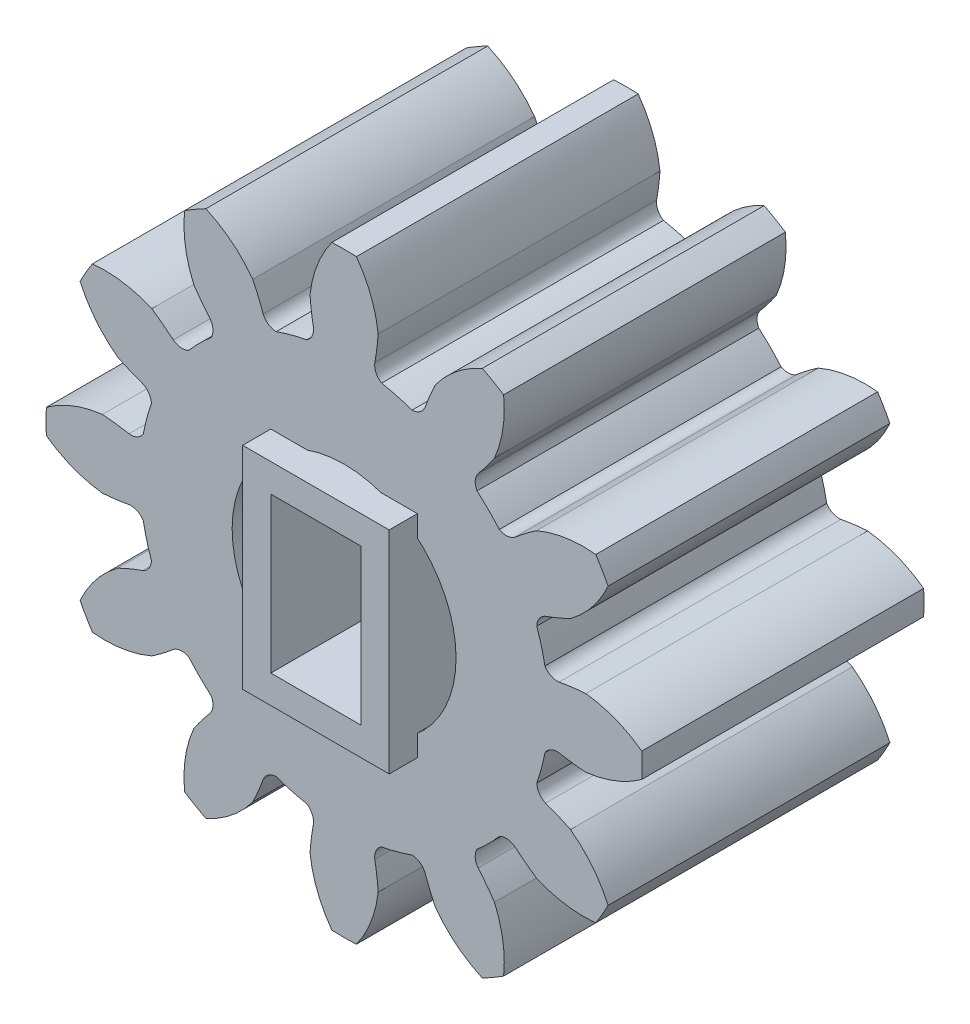
from build123d import *

# Parameters (mm, degrees)
BOSS_EXTRUDE1_DEPTH    = 10
BOSS_EXTRUDE1_2_DEPTH  = 10
BOSS_EXTRUDE1_3_DEPTH  = 10
BOSS_EXTRUDE1_4_DEPTH  = 10
BOSS_EXTRUDE1_5_DEPTH  = 10
BOSS_EXTRUDE1_6_DEPTH  = 10
BOSS_EXTRUDE1_7_DEPTH  = 10
BOSS_EXTRUDE1_8_DEPTH  = 10
BOSS_EXTRUDE1_9_DEPTH  = 10
BOSS_EXTRUDE1_10_DEPTH = 10
BOSS_EXTRUDE1_11_DEPTH = 10
BOSS_EXTRUDE1_12_DEPTH = 10
SKETCH1_R              = 7.25
SKETCH1_R_2            = 3.97260274
BOSS_EXTRUDE2_DEPTH    = 10
SKETCH3_W              = 3.2
SKETCH3_H              = 5.5
BOSS_EXTRUDE4_DEPTH    = 10
SHELL2_T               = 1


with BuildPart() as part:
    # Sketch2 → Boss-Extrude1 (new body)
    with BuildSketch(Plane.XY.offset(20)):
        with BuildLine():
            ThreePointArc((-0.43638137, 31.49092865), (0, 31.50135755), (0.43638137, 31.49092865))
            ThreePointArc((0.43638137, 31.49092865), (0.951639437, 30.546981097), (1.209067941, 29.502826691))
            ThreePointArc((1.209067941, 29.502826691), (1.162093587, 29.026837369), (1.088768363, 28.554189682))
            ThreePointArc((1.088768363, 28.554189682), (1.135140733, 28.267263714), (1.330539856, 28.052098451))
            ThreePointArc((1.330539856, 28.052098451), (0, 28.17523633), (-1.330539856, 28.052098451))
            ThreePointArc((-1.330539856, 28.052098451), (-1.135140733, 28.267263714), (-1.088768363, 28.554189682))
            ThreePointArc((-1.088768363, 28.554189682), (-1.162093587, 29.026837369), (-1.209067941, 29.502826691))
            ThreePointArc((-1.209067941, 29.502826691), (-0.951639437, 30.546981097), (-0.43638137, 31.49092865))
        make_face()
    extrude(amount=BOSS_EXTRUDE1_DEPTH)



with BuildPart() as body_2:
    # Sketch2 → Boss-Extrude1 2 (new body)
    with BuildSketch(Plane.XY.offset(20)):
        with BuildLine():
            ThreePointArc((2.411149745, 27.762549904), (3.625, 27.203920508), (4.715712376, 26.432010048))
            ThreePointArc((4.715712376, 26.432010048), (4.654074403, 26.716048194), (4.757377737, 26.987719556))
            ThreePointArc((4.757377737, 26.987719556), (5.057203087, 27.360381848), (5.335878732, 27.749113515))
            ThreePointArc((5.335878732, 27.749113515), (5.635016311, 28.782092008), (5.660763512, 29.857203603))
            ThreePointArc((5.660763512, 29.857203603), (5.28806061, 30.08442598), (4.904928808, 30.293584973))
            ThreePointArc((4.904928808, 30.293584973), (3.986728456, 29.733731446), (3.241711629, 28.958181456))
            ThreePointArc((3.241711629, 28.958181456), (3.044397952, 28.522475434), (2.871575615, 28.076487919))
            ThreePointArc((2.871575615, 28.076487919), (2.687952981, 27.851188926), (2.411149745, 27.762549904))
        make_face()
    extrude(amount=BOSS_EXTRUDE1_2_DEPTH)


with BuildPart() as body_3:
    # Sketch2 → Boss-Extrude1 3 (new body)
    with BuildSketch(Plane.XY.offset(20)):
        with BuildLine():
            ThreePointArc((5.506773718, 25.640948706), (6.278684177, 24.55023633), (6.837313574, 23.336386075))
            ThreePointArc((6.837313574, 23.336386075), (6.925952596, 23.613189311), (7.151251589, 23.796811945))
            ThreePointArc((7.151251589, 23.796811945), (7.597239104, 23.969634282), (8.032945126, 24.166947959))
            ThreePointArc((8.032945126, 24.166947959), (8.808495116, 24.911964786), (9.368348642, 25.830165138))
            ThreePointArc((9.368348642, 25.830165138), (9.15918965, 26.21329694), (8.931967273, 26.585999842))
            ThreePointArc((8.931967273, 26.585999842), (7.856855678, 26.560252641), (6.823877185, 26.261115062))
            ThreePointArc((6.823877185, 26.261115062), (6.435145518, 25.982439417), (6.062483226, 25.682614067))
            ThreePointArc((6.062483226, 25.682614067), (5.790811864, 25.579310734), (5.506773718, 25.640948706))
        make_face()
    extrude(amount=BOSS_EXTRUDE1_3_DEPTH)


with BuildPart() as body_4:
    # Sketch2 → Boss-Extrude1 4 (new body)
    with BuildSketch(Plane.XY.offset(20)):
        with BuildLine():
            ThreePointArc((7.126862121, 22.255776186), (7.25, 20.92523633), (7.126862121, 19.594696474))
            ThreePointArc((7.126862121, 19.594696474), (7.342027384, 19.790095597), (7.628953352, 19.836467967))
            ThreePointArc((7.628953352, 19.836467967), (8.101601039, 19.763142744), (8.577590361, 19.716168389))
            ThreePointArc((8.577590361, 19.716168389), (9.621744767, 19.973596893), (10.56569232, 20.48885496))
            ThreePointArc((10.56569232, 20.48885496), (10.57612122, 20.92523633), (10.56569232, 21.3616177))
            ThreePointArc((10.56569232, 21.3616177), (9.621744767, 21.876875767), (8.577590361, 22.134304271))
            ThreePointArc((8.577590361, 22.134304271), (8.101601039, 22.087329917), (7.628953352, 22.014004693))
            ThreePointArc((7.628953352, 22.014004693), (7.342027384, 22.060377063), (7.126862121, 22.255776186))
        make_face()
    extrude(amount=BOSS_EXTRUDE1_4_DEPTH)


with BuildPart() as body_5:
    # Sketch2 → Boss-Extrude1 5 (new body)
    with BuildSketch(Plane.XY.offset(20)):
        with BuildLine():
            ThreePointArc((6.837313574, 18.514086585), (6.278684177, 17.30023633), (5.506773718, 16.209523954))
            ThreePointArc((5.506773718, 16.209523954), (5.790811864, 16.271161927), (6.062483226, 16.167858593))
            ThreePointArc((6.062483226, 16.167858593), (6.435145518, 15.868033243), (6.823877185, 15.589357598))
            ThreePointArc((6.823877185, 15.589357598), (7.856855678, 15.290220019), (8.931967273, 15.264472818))
            ThreePointArc((8.931967273, 15.264472818), (9.15918965, 15.63717572), (9.368348642, 16.020307522))
            ThreePointArc((9.368348642, 16.020307522), (8.808495116, 16.938507874), (8.032945126, 17.683524701))
            ThreePointArc((8.032945126, 17.683524701), (7.597239104, 17.880838378), (7.151251589, 18.053660715))
            ThreePointArc((7.151251589, 18.053660715), (6.925952596, 18.237283349), (6.837313574, 18.514086585))
        make_face()
    extrude(amount=BOSS_EXTRUDE1_5_DEPTH)


with BuildPart() as body_6:
    # Sketch2 → Boss-Extrude1 6 (new body)
    with BuildSketch(Plane.XY.offset(20)):
        with BuildLine():
            ThreePointArc((4.715712376, 15.418462612), (3.625, 14.646552153), (2.411149745, 14.087922756))
            ThreePointArc((2.411149745, 14.087922756), (2.687952981, 13.999283734), (2.871575615, 13.773984741))
            ThreePointArc((2.871575615, 13.773984741), (3.044397952, 13.327997226), (3.241711629, 12.892291204))
            ThreePointArc((3.241711629, 12.892291204), (3.986728456, 12.116741215), (4.904928808, 11.556887688))
            ThreePointArc((4.904928808, 11.556887688), (5.28806061, 11.76604668), (5.660763512, 11.993269057))
            ThreePointArc((5.660763512, 11.993269057), (5.635016311, 13.068380652), (5.335878732, 14.101359145))
            ThreePointArc((5.335878732, 14.101359145), (5.057203087, 14.490090812), (4.757377737, 14.862753104))
            ThreePointArc((4.757377737, 14.862753104), (4.654074403, 15.134424466), (4.715712376, 15.418462612))
        make_face()
    extrude(amount=BOSS_EXTRUDE1_6_DEPTH)


with BuildPart() as body_7:
    # Sketch2 → Boss-Extrude1 7 (new body)
    with BuildSketch(Plane.XY.offset(20)):
        with BuildLine():
            ThreePointArc((1.330539856, 13.798374209), (0, 13.67523633), (-1.330539856, 13.798374209))
            ThreePointArc((-1.330539856, 13.798374209), (-1.135140733, 13.583208946), (-1.088768363, 13.296282978))
            ThreePointArc((-1.088768363, 13.296282978), (-1.162093587, 12.823635291), (-1.209067941, 12.347645969))
            ThreePointArc((-1.209067941, 12.347645969), (-0.951639437, 11.303491563), (-0.43638137, 10.35954401))
            ThreePointArc((-0.43638137, 10.35954401), (0, 10.34911511), (0.43638137, 10.35954401))
            ThreePointArc((0.43638137, 10.35954401), (0.951639437, 11.303491563), (1.209067941, 12.347645969))
            ThreePointArc((1.209067941, 12.347645969), (1.162093587, 12.823635291), (1.088768363, 13.296282978))
            ThreePointArc((1.088768363, 13.296282978), (1.135140733, 13.583208946), (1.330539856, 13.798374209))
        make_face()
    extrude(amount=BOSS_EXTRUDE1_7_DEPTH)


with BuildPart() as body_8:
    # Sketch2 → Boss-Extrude1 8 (new body)
    with BuildSketch(Plane.XY.offset(20)):
        with BuildLine():
            ThreePointArc((-2.411149745, 14.087922756), (-3.625, 14.646552153), (-4.715712376, 15.418462612))
            ThreePointArc((-4.715712376, 15.418462612), (-4.654074403, 15.134424466), (-4.757377737, 14.862753104))
            ThreePointArc((-4.757377737, 14.862753104), (-5.057203087, 14.490090812), (-5.335878732, 14.101359145))
            ThreePointArc((-5.335878732, 14.101359145), (-5.635016311, 13.068380652), (-5.660763512, 11.993269057))
            ThreePointArc((-5.660763512, 11.993269057), (-5.28806061, 11.76604668), (-4.904928808, 11.556887688))
            ThreePointArc((-4.904928808, 11.556887688), (-3.986728456, 12.116741215), (-3.241711629, 12.892291204))
            ThreePointArc((-3.241711629, 12.892291204), (-3.044397952, 13.327997226), (-2.871575615, 13.773984741))
            ThreePointArc((-2.871575615, 13.773984741), (-2.687952981, 13.999283734), (-2.411149745, 14.087922756))
        make_face()
    extrude(amount=BOSS_EXTRUDE1_8_DEPTH)


with BuildPart() as body_9:
    # Sketch2 → Boss-Extrude1 9 (new body)
    with BuildSketch(Plane.XY.offset(20)):
        with BuildLine():
            ThreePointArc((-5.506773718, 16.209523954), (-6.278684177, 17.30023633), (-6.837313574, 18.514086585))
            ThreePointArc((-6.837313574, 18.514086585), (-6.925952596, 18.237283349), (-7.151251589, 18.053660715))
            ThreePointArc((-7.151251589, 18.053660715), (-7.597239104, 17.880838378), (-8.032945126, 17.683524701))
            ThreePointArc((-8.032945126, 17.683524701), (-8.808495116, 16.938507874), (-9.368348642, 16.020307522))
            ThreePointArc((-9.368348642, 16.020307522), (-9.15918965, 15.63717572), (-8.931967273, 15.264472818))
            ThreePointArc((-8.931967273, 15.264472818), (-7.856855678, 15.290220019), (-6.823877185, 15.589357598))
            ThreePointArc((-6.823877185, 15.589357598), (-6.435145518, 15.868033243), (-6.062483226, 16.167858593))
            ThreePointArc((-6.062483226, 16.167858593), (-5.790811864, 16.271161927), (-5.506773718, 16.209523954))
        make_face()
    extrude(amount=BOSS_EXTRUDE1_9_DEPTH)


with BuildPart() as body_10:
    # Sketch2 → Boss-Extrude1 10 (new body)
    with BuildSketch(Plane.XY.offset(20)):
        with BuildLine():
            ThreePointArc((-7.126862121, 19.594696474), (-7.25, 20.92523633), (-7.126862121, 22.255776186))
            ThreePointArc((-7.126862121, 22.255776186), (-7.342027384, 22.060377063), (-7.628953352, 22.014004693))
            ThreePointArc((-7.628953352, 22.014004693), (-8.101601039, 22.087329917), (-8.577590361, 22.134304271))
            ThreePointArc((-8.577590361, 22.134304271), (-9.621744767, 21.876875767), (-10.56569232, 21.3616177))
            ThreePointArc((-10.56569232, 21.3616177), (-10.57612122, 20.92523633), (-10.56569232, 20.48885496))
            ThreePointArc((-10.56569232, 20.48885496), (-9.621744767, 19.973596893), (-8.577590361, 19.716168389))
            ThreePointArc((-8.577590361, 19.716168389), (-8.101601039, 19.763142744), (-7.628953352, 19.836467967))
            ThreePointArc((-7.628953352, 19.836467967), (-7.342027384, 19.790095597), (-7.126862121, 19.594696474))
        make_face()
    extrude(amount=BOSS_EXTRUDE1_10_DEPTH)


with BuildPart() as body_11:
    # Sketch2 → Boss-Extrude1 11 (new body)
    with BuildSketch(Plane.XY.offset(20)):
        with BuildLine():
            ThreePointArc((-6.837313574, 23.336386075), (-6.278684177, 24.55023633), (-5.506773718, 25.640948706))
            ThreePointArc((-5.506773718, 25.640948706), (-5.790811864, 25.579310734), (-6.062483226, 25.682614067))
            ThreePointArc((-6.062483226, 25.682614067), (-6.435145518, 25.982439417), (-6.823877185, 26.261115062))
            ThreePointArc((-6.823877185, 26.261115062), (-7.856855678, 26.560252641), (-8.931967273, 26.585999842))
            ThreePointArc((-8.931967273, 26.585999842), (-9.15918965, 26.21329694), (-9.368348642, 25.830165138))
            ThreePointArc((-9.368348642, 25.830165138), (-8.808495116, 24.911964786), (-8.032945126, 24.166947959))
            ThreePointArc((-8.032945126, 24.166947959), (-7.597239104, 23.969634282), (-7.151251589, 23.796811945))
            ThreePointArc((-7.151251589, 23.796811945), (-6.925952596, 23.613189311), (-6.837313574, 23.336386075))
        make_face()
    extrude(amount=BOSS_EXTRUDE1_11_DEPTH)


with BuildPart() as body_12:
    # Sketch2 → Boss-Extrude1 12 (new body)
    with BuildSketch(Plane.XY.offset(20)):
        with BuildLine():
            ThreePointArc((-4.715712376, 26.432010048), (-3.625, 27.203920508), (-2.411149745, 27.762549904))
            ThreePointArc((-2.411149745, 27.762549904), (-2.687952981, 27.851188926), (-2.871575615, 28.076487919))
            ThreePointArc((-2.871575615, 28.076487919), (-3.044397952, 28.522475434), (-3.241711629, 28.958181456))
            ThreePointArc((-3.241711629, 28.958181456), (-3.986728456, 29.733731446), (-4.904928808, 30.293584973))
            ThreePointArc((-4.904928808, 30.293584973), (-5.28806061, 30.08442598), (-5.660763512, 29.857203603))
            ThreePointArc((-5.660763512, 29.857203603), (-5.635016311, 28.782092008), (-5.335878732, 27.749113515))
            ThreePointArc((-5.335878732, 27.749113515), (-5.057203087, 27.360381848), (-4.757377737, 26.987719556))
            ThreePointArc((-4.757377737, 26.987719556), (-4.654074403, 26.716048194), (-4.715712376, 26.432010048))
        make_face()
    extrude(amount=BOSS_EXTRUDE1_12_DEPTH)


with BuildPart() as part_1:
    add(part.part)

    add(body_2.part)  # Boss-Extrude2 merges body 2

    add(body_3.part)  # Boss-Extrude2 merges body 3

    add(body_4.part)  # Boss-Extrude2 merges body 4

    add(body_5.part)  # Boss-Extrude2 merges body 5

    add(body_6.part)  # Boss-Extrude2 merges body 6

    add(body_7.part)  # Boss-Extrude2 merges body 7

    add(body_8.part)  # Boss-Extrude2 merges body 8

    add(body_9.part)  # Boss-Extrude2 merges body 9

    add(body_10.part)  # Boss-Extrude2 merges body 10

    add(body_11.part)  # Boss-Extrude2 merges body 11

    add(body_12.part)  # Boss-Extrude2 merges body 12
    # Sketch1 → Boss-Extrude2 (add)
    with BuildSketch(Plane.XY.offset(20)):
        with Locations((0, 20.92523633)):
            Circle(SKETCH1_R)
        with Locations((0, 20.92523633)):
            Circle(SKETCH1_R_2, mode=Mode.SUBTRACT)
    extrude(amount=BOSS_EXTRUDE2_DEPTH)


with BuildPart() as body_2_2:
    # Sketch3 → Boss-Extrude4 (new body)
    with BuildSketch(Plane.XY.offset(31)):
        with Locations((0, 20.92523633)):
            Rectangle(SKETCH3_W, SKETCH3_H)
    extrude(amount=-BOSS_EXTRUDE4_DEPTH)

    # Shell2
    shell2_openings = [body_2_2.faces().sort_by_distance(p)[0] for p in [
        (0, 20.92523633, 31),
    ]]
    offset(amount=SHELL2_T, openings=shell2_openings, kind=Kind.INTERSECTION)


solid = Compound([part_1.part, body_2_2.part])
